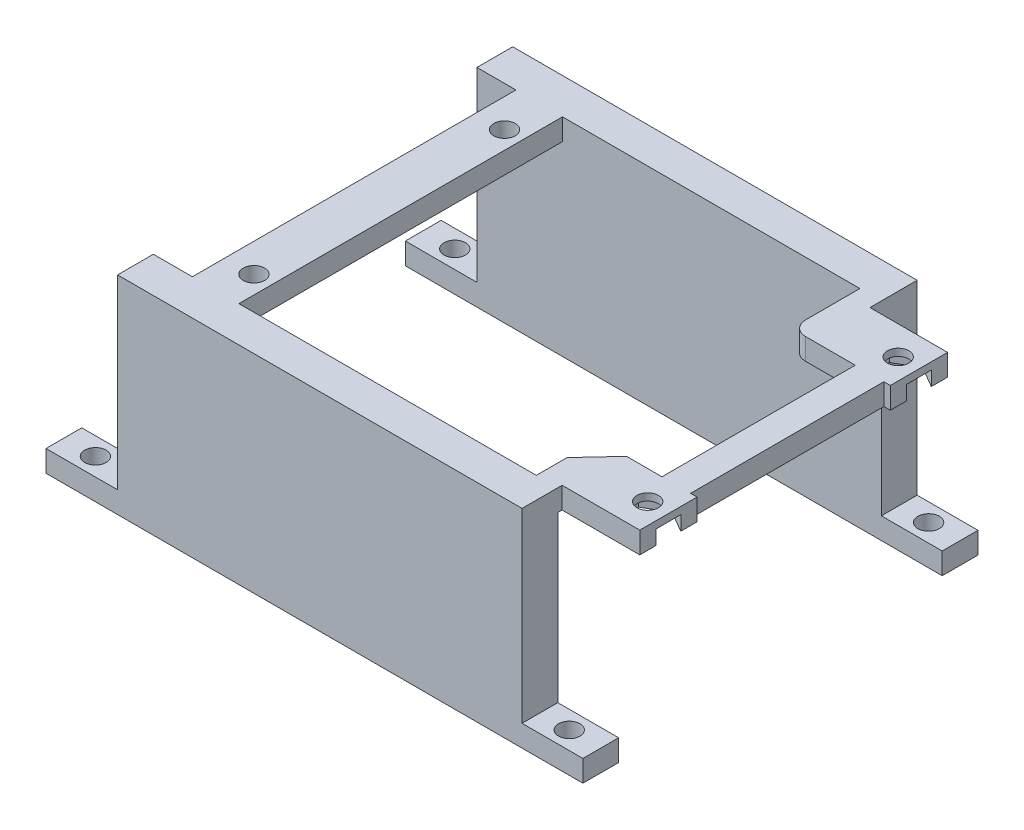
from build123d import *

# Parameters (mm, degrees)
SZKIC1_W                      = 75
SZKIC1_H                      = 5
SZKIC1_R                      = 1.5
DODANIE_WYCI_GNI_CIE1_DEPTH   = 29
DODANIE_WYCI_GNI_CIE1_2_DEPTH = 29
SZKIC2_W                      = 10
SZKIC2_H                      = 5
WYTNIJ_WYCI_GNI_CIE1_DEPTH    = 26
SZKIC3_W                      = 4
SZKIC3_H                      = 55.2
SZKIC3_R                      = 1.5
SZKIC3_W_2                    = 8
DODANIE_WYCI_GNI_CIE6_DEPTH   = 3
SZKIC8_W                      = 2
SZKIC8_H                      = 8
DODANIE_WYCI_GNI_CIE7_DEPTH   = 3
WYTNIJ_WYCI_GNI_CIE3_REACH    = 59.268
SZKIC9_W                      = 4
SZKIC9_H                      = 6.6
SZKIC9_H_2                    = 5.6
WYTNIJ_WYCI_GNI_CIE4_DEPTH    = 2
WYTNIJ_WYCI_GNI_CIE5_START    = -3
SZKIC11_W                     = 1.1
SZKIC11_H                     = 43
WYTNIJ_WYCI_GNI_CIE5_DEPTH    = 3
SZKIC12_W                     = 5
SZKIC12_H                     = 23
DODANIE_WYCI_GNI_CIE8_DEPTH   = 1.5
WYTNIJ_WYCI_GNI_CIE6_REACH    = 58.487
ZAOKR_GLENIE1_R               = 2
WYTNIJ_WYCI_GNI_CIE7_REACH    = 58.487
SZKIC14_W                     = 1.5
SZKIC14_H                     = 45.2


with BuildPart() as part:
    # Szkic1 → Dodanie-wyciągnięcie1 (new body)
    with BuildSketch(Plane(origin=(0, 0, 0), x_dir=(1, 0, 0), z_dir=(0, 1, 0))):
        with Locations((0, 25.1)):
            Rectangle(SZKIC1_W, SZKIC1_H)
        with Locations(Location((-33.1, 25.1, 0), (0, 0, 90))):
            Circle(SZKIC1_R, mode=Mode.SUBTRACT)
        with Locations(Location((33.1, 25.1, 0), (0, 0, 90))):
            Circle(SZKIC1_R, mode=Mode.SUBTRACT)
    extrude(amount=DODANIE_WYCI_GNI_CIE1_DEPTH)


with BuildPart() as body_2:
    # Szkic1 → Dodanie-wyci_gni_cie1 2 (new body)
    with BuildSketch(Plane(origin=(0, 0, 0), x_dir=(1, 0, 0), z_dir=(0, 1, 0))):
        with Locations((0, -25.1)):
            Rectangle(SZKIC1_W, SZKIC1_H)
        with Locations(Location((33.1, -25.1, 0), (0, 0, 90))):
            Circle(SZKIC1_R, mode=Mode.SUBTRACT)
        with Locations(Location((-33.1, -25.1, 0), (0, 0, 90))):
            Circle(SZKIC1_R, mode=Mode.SUBTRACT)
    extrude(amount=DODANIE_WYCI_GNI_CIE1_2_DEPTH)


with BuildPart() as wytnij_wyci_gni_cie1_tool:
    # Szkic2 → Wytnij-wyciągnięcie1 (new body)
    with BuildSketch(Plane(origin=(0, 29, 0), x_dir=(1, 0, 0), z_dir=(0, 1, 0))):
        with Locations((-32.5, 25.1)):
            Rectangle(SZKIC2_W, SZKIC2_H)
        with Locations((32.5, 25.1)):
            Rectangle(SZKIC2_W, SZKIC2_H)
        with Locations((32.5, -25.1)):
            Rectangle(SZKIC2_W, SZKIC2_H)
        with Locations((-32.5, -25.1)):
            Rectangle(SZKIC2_W, SZKIC2_H)
    extrude(amount=-WYTNIJ_WYCI_GNI_CIE1_DEPTH)


with BuildPart() as part_1:
    add(part.part)

    # Wytnij-wyciągnięcie1: cut by wytnij_wyci_gni_cie1_tool
    add(wytnij_wyci_gni_cie1_tool.part, mode=Mode.SUBTRACT)



with BuildPart() as body_2_1:
    add(body_2.part)

    # Wytnij-wyciągnięcie1: cut by wytnij_wyci_gni_cie1_tool
    add(wytnij_wyci_gni_cie1_tool.part, mode=Mode.SUBTRACT)


with BuildPart() as part_2:
    add(part_1.part)

    add(body_2_1.part)  # Dodanie-wyciągnięcie6 merges body 2
    # Szkic3 → Dodanie-wyciągnięcie6 (add)
    # profile 1 of 2: a face of its own
    with BuildSketch(Plane(origin=(0, 29, 0), x_dir=(1, 0, 0), z_dir=(0, 1, 0))):
        with Locations((36.95, 0)):
            Rectangle(SZKIC3_W, SZKIC3_H)
        with Locations(Location((36.95, -18, 0), (0, 0, 270))):
            Circle(SZKIC3_R, mode=Mode.SUBTRACT)
        with Locations(Location((36.95, 17, 0), (0, 0, 270))):
            Circle(SZKIC3_R, mode=Mode.SUBTRACT)
    # profile 2 of 2: a face of its own
    with BuildSketch(Plane(origin=(0, 29, 0), x_dir=(1, 0, 0), z_dir=(0, 1, 0))):
        with Locations((-18.05, 0)):
            Rectangle(SZKIC3_W_2, SZKIC3_H)
        with Locations(Location((-18.05, -18, 0), (0, 0, 270))):
            Circle(SZKIC3_R, mode=Mode.SUBTRACT)
        with Locations(Location((-18.05, 17, 0), (0, 0, 270))):
            Circle(SZKIC3_R, mode=Mode.SUBTRACT)
    extrude(amount=-DODANIE_WYCI_GNI_CIE6_DEPTH)

    # Szkic8 → Dodanie-wyciągnięcie7 (add)
    with BuildSketch(Plane(origin=(0, 29, 0), x_dir=(1, 0, 0), z_dir=(0, 1, 0))):
        Polygon((29, 21), (29, 27.6), (27.5, 27.6), (27.5, 22.6), (26, 22.6), (26, 13), (34.95, 13), (34.95, 21), align=None)
        with Locations((39.95, 17)):
            Rectangle(SZKIC8_W, SZKIC8_H)
        Polygon((34.95, -22), (34.95, -14), (26, -14), (26, -22.6), (27.5, -22.6), (27.5, -27.6), (29, -27.6), (29, -22), align=None)
        with Locations((39.95, -18)):
            Rectangle(SZKIC8_W, SZKIC8_H)
    extrude(amount=-DODANIE_WYCI_GNI_CIE7_DEPTH)

    # Szkic9 → Wytnij-wyciągnięcie3 (cut, up to next)
    with BuildSketch(Plane(origin=(0, 29, 0), x_dir=(1, 0, 0), z_dir=(0, 1, 0)), mode=Mode.PRIVATE) as wytnij_wyci_gni_cie3_sk1:
        with Locations((36.95, 24.3)):
            Rectangle(SZKIC9_W, SZKIC9_H)
    wytnij_wyci_gni_cie3_tool1 = extrude(wytnij_wyci_gni_cie3_sk1.sketch, amount=-WYTNIJ_WYCI_GNI_CIE3_REACH, mode=Mode.PRIVATE) & part_2.part
    # Szkic9 → Wytnij-wyciągnięcie3 (cut, up to next)
    with BuildSketch(Plane(origin=(0, 29, 0), x_dir=(1, 0, 0), z_dir=(0, 1, 0)), mode=Mode.PRIVATE) as wytnij_wyci_gni_cie3_sk2:
        with Locations((36.95, -24.8)):
            Rectangle(SZKIC9_W, SZKIC9_H_2)
    wytnij_wyci_gni_cie3_tool2 = extrude(wytnij_wyci_gni_cie3_sk2.sketch, amount=-WYTNIJ_WYCI_GNI_CIE3_REACH, mode=Mode.PRIVATE) & part_2.part
    add(wytnij_wyci_gni_cie3_tool1.solids().sort_by_distance((36.95, 29, -24.3))[0], mode=Mode.SUBTRACT)
    add(wytnij_wyci_gni_cie3_tool2.solids().sort_by_distance((36.95, 29, 24.8))[0], mode=Mode.SUBTRACT)

    # Szkic10 → Wytnij-wyciągnięcie4 (cut)
    with BuildSketch(Plane.XZ.offset(-26)):
        Polygon((36.95, -13.593633412), (34, -15.296816706), (34, -18.703183294), (36.95, -20.406366588), (39.9, -18.703183294), (39.9, -15.296816706), align=None)
        Polygon((36.95, 21.406366588), (34, 19.703183294), (34, 16.296816706), (36.95, 14.593633412), (39.9, 16.296816706), (39.9, 19.703183294), align=None)
    extrude(amount=-WYTNIJ_WYCI_GNI_CIE4_DEPTH, mode=Mode.SUBTRACT)

    # Szkic11 → Wytnij-wyciągnięcie5 (cut)
    with BuildSketch(Plane(origin=(0, 29, 0), x_dir=(1, 0, 0), z_dir=(0, 1, 0)).offset(WYTNIJ_WYCI_GNI_CIE5_START)):
        with Locations((40.4, -0.5)):
            Rectangle(SZKIC11_W, SZKIC11_H)
    extrude(amount=WYTNIJ_WYCI_GNI_CIE5_DEPTH, mode=Mode.SUBTRACT)

    # Szkic12 → Dodanie-wyciągnięcie8 (add)
    with BuildSketch(Plane(origin=(27.5, 0, 0), x_dir=(0, 0, -1), z_dir=(1, 0, 0))):
        with Locations((-25.1, 14.5)):
            Rectangle(SZKIC12_W, SZKIC12_H)
        with Locations((25.1, 14.5)):
            Rectangle(SZKIC12_W, SZKIC12_H)
    extrude(amount=DODANIE_WYCI_GNI_CIE8_DEPTH)

    # Szkic13 → Wytnij-wyciągnięcie6 (cut, up to next)
    with BuildSketch(Plane(origin=(0, 29, 0), x_dir=(1, 0, 0), z_dir=(0, 1, 0)), mode=Mode.PRIVATE) as wytnij_wyci_gni_cie6_sk1:
        Polygon((26, -14), (30, -14), (26, -18.3), align=None)
    wytnij_wyci_gni_cie6_tool1 = extrude(wytnij_wyci_gni_cie6_sk1.sketch, amount=-WYTNIJ_WYCI_GNI_CIE6_REACH, mode=Mode.PRIVATE) & part_2.part
    add(wytnij_wyci_gni_cie6_tool1.solids().sort_by_distance((27.333333, 29, 15.433333))[0], mode=Mode.SUBTRACT)

    # Zaokrąglenie1
    zaokr_glenie1_edges = [part_2.edges().sort_by_distance(p)[0] for p in [
        (26, 27.5, -13),
    ]]
    fillet(zaokr_glenie1_edges, radius=ZAOKR_GLENIE1_R)

    # Szkic14 → Wytnij-wyciągnięcie7 (cut, up to next)
    with BuildSketch(Plane(origin=(0, 29, 0), x_dir=(1, 0, 0), z_dir=(0, 1, 0)), mode=Mode.PRIVATE) as wytnij_wyci_gni_cie7_sk1:
        with Locations((-14.8, 0)):
            Rectangle(SZKIC14_W, SZKIC14_H)
    wytnij_wyci_gni_cie7_tool1 = extrude(wytnij_wyci_gni_cie7_sk1.sketch, amount=-WYTNIJ_WYCI_GNI_CIE7_REACH, mode=Mode.PRIVATE) & part_2.part
    add(wytnij_wyci_gni_cie7_tool1.solids().sort_by_distance((-14.8, 29, 0))[0], mode=Mode.SUBTRACT)


solid = part_2.part
